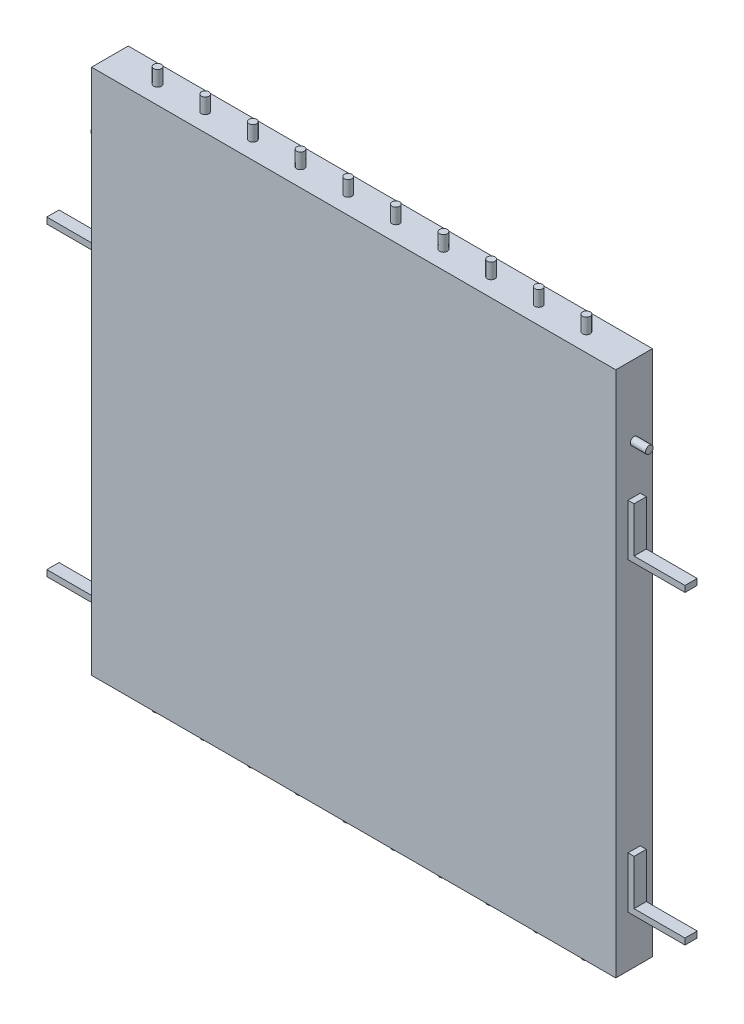
from build123d import *

# Parameters (mm, degrees)
SKETCH1_W               = 1030
SKETCH1_H               = 1035
BOSS_EXTRUDE1_DEPTH     = 72
SKETCH2_R               = 7.5
BOSS_EXTRUDE2_DEPTH     = 30
SKETCH3_W               = 24
SKETCH3_H               = 101
BOSS_EXTRUDE3_DEPTH     = 12
SKETCH4_W               = 24
SKETCH4_H               = 12
BOSS_EXTRUDE4_DEPTH     = 100
LPATTERN1_COUNT         = 2
LPATTERN1_PITCH         = 600
MIRROR2_COPY_1_SKETCH_W = 24
MIRROR2_COPY_1_SKETCH_H = 101
MIRROR2_COPY_1_DEPTH    = 12
MIRROR2_COPY_2_SKETCH_W = 24
MIRROR2_COPY_2_SKETCH_H = 12
MIRROR2_COPY_2_DEPTH    = 100
SKETCH6_R               = 7.5
BOSS_EXTRUDE5_DEPTH     = 30
LPATTERN2_COUNT         = 10
LPATTERN2_PITCH         = 93.6364
MIRROR3_COPY_1_SKETCH_R = 7.5
MIRROR3_COPY_1_DEPTH    = 30
MIRROR3_COPY_2_SKETCH_R = 7.5
MIRROR3_COPY_2_DEPTH    = 30
MIRROR3_COPY_3_SKETCH_R = 7.5
MIRROR3_COPY_3_DEPTH    = 30
MIRROR3_COPY_4_SKETCH_R = 7.5
MIRROR3_COPY_4_DEPTH    = 30
MIRROR3_COPY_5_SKETCH_R = 7.5
MIRROR3_COPY_5_DEPTH    = 30
MIRROR3_COPY_6_SKETCH_R = 7.5
MIRROR3_COPY_6_DEPTH    = 30
MIRROR3_COPY_7_SKETCH_R = 7.5
MIRROR3_COPY_7_DEPTH    = 30
MIRROR3_COPY_8_SKETCH_R = 7.5
MIRROR3_COPY_8_DEPTH    = 30
MIRROR3_COPY_9_SKETCH_R = 7.5
MIRROR3_COPY_9_DEPTH    = 30


with BuildPart() as part:
    # Sketch1 → Boss-Extrude1 (new body)
    with BuildSketch(Plane.XY):
        Rectangle(SKETCH1_W, SKETCH1_H)
    extrude(amount=BOSS_EXTRUDE1_DEPTH)

    # Sketch2 → Boss-Extrude2 (add)
    with BuildSketch(Plane(origin=(515, 0, 0), x_dir=(0, 0, -1), z_dir=(1, 0, 0))):
        with Locations(Location((-36, 378.5, 0), (0, 0, 180))):
            Circle(SKETCH2_R)
    boss_extrude2 = extrude(amount=BOSS_EXTRUDE2_DEPTH)

    # Sketch3 → Boss-Extrude3 (add)
    with BuildSketch(Plane(origin=(515, 0, 0), x_dir=(0, 0, -1), z_dir=(1, 0, 0))):
        with Locations((-36, 233)):
            Rectangle(SKETCH3_W, SKETCH3_H)
    boss_extrude3 = extrude(amount=BOSS_EXTRUDE3_DEPTH)

    # Sketch4 → Boss-Extrude4 (add)
    with BuildSketch(Plane(origin=(527, 0, 0), x_dir=(0, 0, -1), z_dir=(1, 0, 0))):
        with Locations((-36, 188.5)):
            Rectangle(SKETCH4_W, SKETCH4_H)
    boss_extrude4 = extrude(amount=BOSS_EXTRUDE4_DEPTH)

    # LPattern1: Boss-Extrude3, Boss-Extrude4 ×2
    with Locations(*[(0, -i * LPATTERN1_PITCH, 0) for i in range(1, LPATTERN1_COUNT)]):
        add(boss_extrude3)
        add(boss_extrude4)

    # Mirror2: Boss-Extrude2, Boss-Extrude3, Boss-Extrude4 across plane
    add(boss_extrude2.mirror(Plane(origin=(0, 0, 0), x_dir=(0, 0, 1), z_dir=(1, 0, 0))))
    add(boss_extrude3.mirror(Plane(origin=(0, 0, 0), x_dir=(0, 0, 1), z_dir=(1, 0, 0))))
    add(boss_extrude4.mirror(Plane(origin=(0, 0, 0), x_dir=(0, 0, 1), z_dir=(1, 0, 0))))

    # Mirror2 copy 1 sketch → Mirror2 copy 1 (add)
    with BuildSketch(Plane(origin=(-515, -600, 0), x_dir=(0, 0, -1), z_dir=(-1, 0, 0))):
        with Locations((-36, -233)):
            Rectangle(MIRROR2_COPY_1_SKETCH_W, MIRROR2_COPY_1_SKETCH_H)
    extrude(amount=MIRROR2_COPY_1_DEPTH)

    # Mirror2 copy 2 sketch → Mirror2 copy 2 (add)
    with BuildSketch(Plane(origin=(-527, -600, 0), x_dir=(0, 0, -1), z_dir=(-1, 0, 0))):
        with Locations((-36, -188.5)):
            Rectangle(MIRROR2_COPY_2_SKETCH_W, MIRROR2_COPY_2_SKETCH_H)
    extrude(amount=MIRROR2_COPY_2_DEPTH)

    # Sketch6 → Boss-Extrude5 (add)
    with BuildSketch(Plane(origin=(0, 517.5, 0), x_dir=(1, 0, 0), z_dir=(0, 1, 0))):
        with Locations(Location((421.3636, -36, 0), (0, 0, 90))):
            Circle(SKETCH6_R)
    boss_extrude5 = extrude(amount=BOSS_EXTRUDE5_DEPTH)

    # LPattern2: Boss-Extrude5 ×10
    with Locations(*[(-i * LPATTERN2_PITCH, 0, 0) for i in range(1, LPATTERN2_COUNT)]):
        add(boss_extrude5)

    # Mirror3: Boss-Extrude5 across plane
    add(boss_extrude5.mirror(Plane.ZX))

    # Mirror3 copy 1 sketch → Mirror3 copy 1 (add)
    with BuildSketch(Plane(origin=(-93.6364, -517.5, 0), x_dir=(1, 0, 0), z_dir=(0, -1, 0))):
        with Locations((421.3636, 36)):
            Circle(MIRROR3_COPY_1_SKETCH_R)
    extrude(amount=MIRROR3_COPY_1_DEPTH)

    # Mirror3 copy 2 sketch → Mirror3 copy 2 (add)
    with BuildSketch(Plane(origin=(-187.2728, -517.5, 0), x_dir=(1, 0, 0), z_dir=(0, -1, 0))):
        with Locations((421.3636, 36)):
            Circle(MIRROR3_COPY_2_SKETCH_R)
    extrude(amount=MIRROR3_COPY_2_DEPTH)

    # Mirror3 copy 3 sketch → Mirror3 copy 3 (add)
    with BuildSketch(Plane(origin=(-280.9092, -517.5, 0), x_dir=(1, 0, 0), z_dir=(0, -1, 0))):
        with Locations((421.3636, 36)):
            Circle(MIRROR3_COPY_3_SKETCH_R)
    extrude(amount=MIRROR3_COPY_3_DEPTH)

    # Mirror3 copy 4 sketch → Mirror3 copy 4 (add)
    with BuildSketch(Plane(origin=(-374.5456, -517.5, 0), x_dir=(1, 0, 0), z_dir=(0, -1, 0))):
        with Locations((421.3636, 36)):
            Circle(MIRROR3_COPY_4_SKETCH_R)
    extrude(amount=MIRROR3_COPY_4_DEPTH)

    # Mirror3 copy 5 sketch → Mirror3 copy 5 (add)
    with BuildSketch(Plane(origin=(-468.182, -517.5, 0), x_dir=(1, 0, 0), z_dir=(0, -1, 0))):
        with Locations((421.3636, 36)):
            Circle(MIRROR3_COPY_5_SKETCH_R)
    extrude(amount=MIRROR3_COPY_5_DEPTH)

    # Mirror3 copy 6 sketch → Mirror3 copy 6 (add)
    with BuildSketch(Plane(origin=(-561.8184, -517.5, 0), x_dir=(1, 0, 0), z_dir=(0, -1, 0))):
        with Locations((421.3636, 36)):
            Circle(MIRROR3_COPY_6_SKETCH_R)
    extrude(amount=MIRROR3_COPY_6_DEPTH)

    # Mirror3 copy 7 sketch → Mirror3 copy 7 (add)
    with BuildSketch(Plane(origin=(-655.4548, -517.5, 0), x_dir=(1, 0, 0), z_dir=(0, -1, 0))):
        with Locations((421.3636, 36)):
            Circle(MIRROR3_COPY_7_SKETCH_R)
    extrude(amount=MIRROR3_COPY_7_DEPTH)

    # Mirror3 copy 8 sketch → Mirror3 copy 8 (add)
    with BuildSketch(Plane(origin=(-749.0912, -517.5, 0), x_dir=(1, 0, 0), z_dir=(0, -1, 0))):
        with Locations((421.3636, 36)):
            Circle(MIRROR3_COPY_8_SKETCH_R)
    extrude(amount=MIRROR3_COPY_8_DEPTH)

    # Mirror3 copy 9 sketch → Mirror3 copy 9 (add)
    with BuildSketch(Plane(origin=(-842.7276, -517.5, 0), x_dir=(1, 0, 0), z_dir=(0, -1, 0))):
        with Locations((421.3636, 36)):
            Circle(MIRROR3_COPY_9_SKETCH_R)
    extrude(amount=MIRROR3_COPY_9_DEPTH)


solid = part.part
